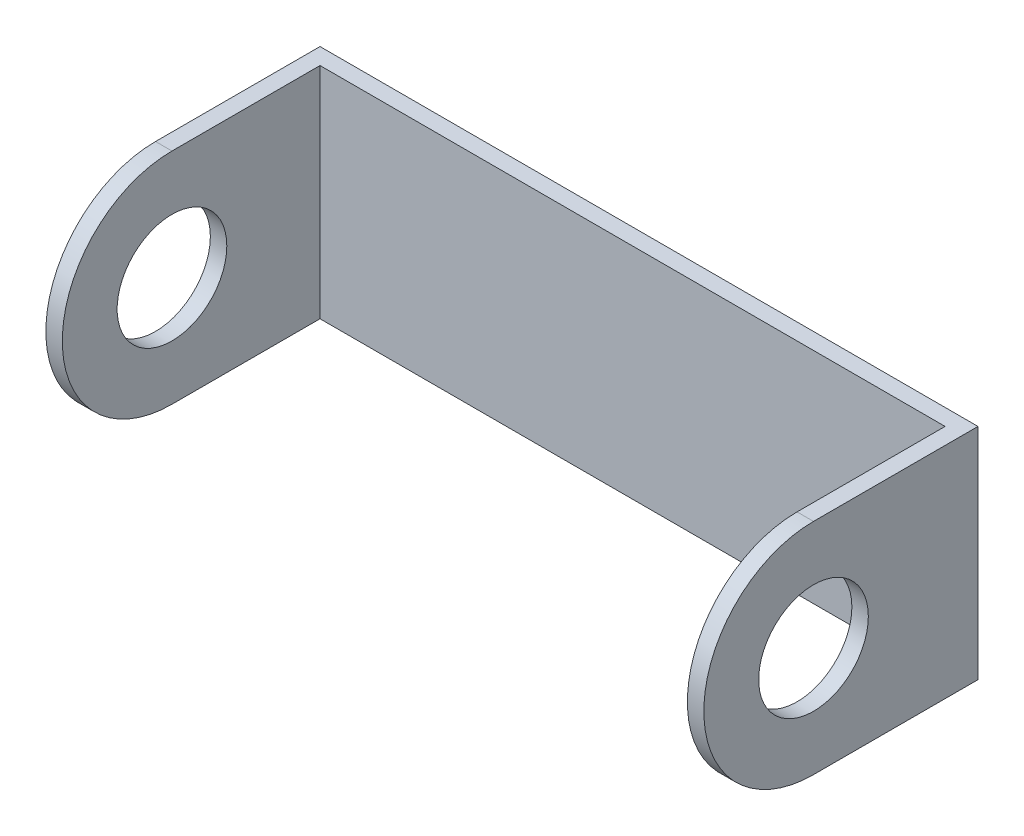
from build123d import *

# Parameters (mm, degrees)
SKETCH_1_W      = 3
SKETCH_1_H      = 40
EXTRUDE_1_DEPTH = 57
SKETCH_2_R      = 10
EXTRUDE_2_DEPTH = 3


with BuildPart() as part:
    # 스케치1 → 보스-돌출1 (new, symmetric)
    with BuildSketch(Plane(origin=(0, 0, 0), x_dir=(0, 0, -1), z_dir=(1, 0, 0))):
        with Locations((-1.5, 0)):
            Rectangle(SKETCH_1_W, SKETCH_1_H)
    extrude(amount=EXTRUDE_1_DEPTH, both=True)

    # 스케치2 → 보스-돌출2 (add)
    with BuildSketch(Plane(origin=(57, 0, 0), x_dir=(0, 0, -1), z_dir=(1, 0, 0))):
        with BuildLine():
            Line((0, 20), (-30, 20))
            ThreePointArc((-30, 20), (-50, 0), (-30, -20))
            Line((-30, -20), (0, -20))
            Line((0, -20), (0, 20))
        make_face()
        with Locations((-30, 0)):
            Circle(SKETCH_2_R, mode=Mode.SUBTRACT)
    extrude_2 = extrude(amount=EXTRUDE_2_DEPTH)

    # 대칭 복사1: 보스-돌출2 across plane
    add(extrude_2.mirror(Plane(origin=(0, 0, 0), x_dir=(0, 0, 1), z_dir=(1, 0, 0))))


solid = part.part
